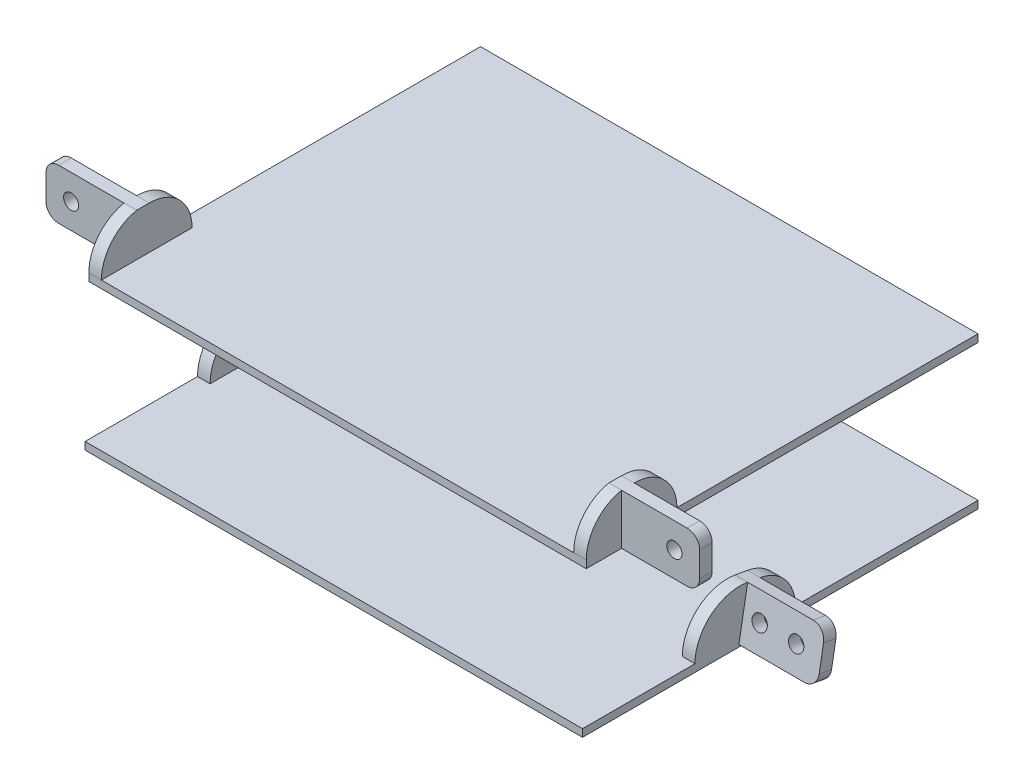
from build123d import *

# Parameters (mm, degrees)
SKETCH1_R                        = 3
LOWER_LEFT_TAB_DEPTH             = 5
BOTTOM_START                     = -5
SKETCH2_W                        = 157
SKETCH2_H                        = 3
BOTTOM_PLATE_EXTRUDE_DEPTH       = 98.75
BOTTOM_TAB_SUPPORT_EXTRUDE_DEPTH = 5
SKETCH5_R                        = 3
TOP_TAB_EXTRUDE_DEPTH            = 5
TOP_START                        = -5
SKETCH6_W                        = 155.527036446
SKETCH6_H                        = 3
TOP_PLATE_EXTRUDE_DEPTH          = 98.75
TOP_TAB_SUPPORT_EXTRUDE_DEPTH    = 5


with BuildPart() as part:
    # Sketch1 → Lower left tab (new body)
    with BuildSketch(Plane(origin=(0, 0, 0), x_dir=(1, 0, 0), z_dir=(0, 0.17364817766693072, 0.984807753012208))):
        with BuildLine():
            Line((-124.75, 10), (-93.75, 10))
            Line((-93.75, 10), (-93.75, -10))
            Line((-93.75, -10), (-124.75, -10))
            ThreePointArc((-124.75, -10), (-128.285533906, -8.535533906), (-129.75, -5))
            Line((-129.75, -5), (-129.75, 5))
            ThreePointArc((-129.75, 5), (-128.285533906, 8.535533906), (-124.75, 10))
        make_face()
        with Locations(Location((-119.75, 0, 0), (0, 0, 270))):
            Circle(SKETCH1_R, mode=Mode.SUBTRACT)
        with Locations(Location((-105.25, 0, 0), (0, 0, 270))):
            Circle(SKETCH1_R, mode=Mode.SUBTRACT)
    lower_left_tab = extrude(amount=LOWER_LEFT_TAB_DEPTH)

    # Sketch2 → Bottom plate extrude (add)
    with BuildSketch(Plane(origin=(-93.75, 0, 0), x_dir=(0, 0, -1), z_dir=(1, 0, 0)).offset(BOTTOM_START)):
        with Locations((9.763518223, -8.34807753)):
            Rectangle(SKETCH2_W, SKETCH2_H)
    bottom_plate_extrude = extrude(amount=BOTTOM_PLATE_EXTRUDE_DEPTH)

    # Sketch4 → Bottom tab support extrude (add)
    with BuildSketch(Plane(origin=(-93.75, 0, 0), x_dir=(0, 0, -1), z_dir=(1, 0, 0))):
        with BuildLine():
            Line((15.74621933, -6.84807753), (-1.207500835, -6.84807753))
            Line((-1.207500835, -6.84807753), (1.736481777, 9.84807753))
            ThreePointArc((1.736481777, 9.84807753), (11.779802288, 4.04956373), (15.74621933, -6.84807753))
        make_face()
        with BuildLine():
            Line((-6.284633894, -6.84807753), (-3.187556988, 10.716318418))
            ThreePointArc((-3.187556988, 10.716318418), (-17.748979146, 6.814597111), (-24.119988962, -6.84807753))
            Line((-24.119988962, -6.84807753), (-6.284633894, -6.84807753))
        make_face()
    bottom_tab_support_extrude = extrude(amount=-BOTTOM_TAB_SUPPORT_EXTRUDE_DEPTH)


with BuildPart() as body_2:
    # Sketch5 → Top tab extrude (new body)
    with BuildSketch(Plane.XY.offset(48.263518223)):
        with BuildLine():
            Line((-124.75, 67.40192247), (-93.75, 67.40192247))
            Line((-93.75, 67.40192247), (-93.75, 47.40192247))
            Line((-93.75, 47.40192247), (-124.75, 47.40192247))
            ThreePointArc((-124.75, 47.40192247), (-128.285533906, 48.866388564), (-129.75, 52.40192247))
            Line((-129.75, 52.40192247), (-129.75, 62.40192247))
            ThreePointArc((-129.75, 62.40192247), (-128.285533906, 65.937456376), (-124.75, 67.40192247))
        make_face()
        with Locations((-119.75, 57.40192247)):
            Circle(SKETCH5_R, mode=Mode.SUBTRACT)
    top_tab_extrude = extrude(amount=TOP_TAB_EXTRUDE_DEPTH)

    # Sketch6 → Top plate extrude (add)
    with BuildSketch(Plane(origin=(-93.75, 0, 0), x_dir=(0, 0, -1), z_dir=(1, 0, 0)).offset(TOP_START)):
        with Locations((10.5, 48.90192247)):
            Rectangle(SKETCH6_W, SKETCH6_H)
    top_plate_extrude = extrude(amount=TOP_PLATE_EXTRUDE_DEPTH)

    # Sketch7 → Top tab support extrude (add)
    with BuildSketch(Plane(origin=(-93.75, 0, 0), x_dir=(0, 0, -1), z_dir=(1, 0, 0))):
        with BuildLine():
            Line((-48.263518223, 50.40192247), (-48.263518223, 67.40192247))
            ThreePointArc((-48.263518223, 67.40192247), (-36.242702943, 62.42273775), (-31.263518223, 50.40192247))
            Line((-31.263518223, 50.40192247), (-48.263518223, 50.40192247))
        make_face()
        with BuildLine():
            Line((-53.263518223, 50.40192247), (-53.263518223, 67.40192247))
            ThreePointArc((-53.263518223, 67.40192247), (-63.31302409, 61.413280243), (-67.263518223, 50.40192247))
            Line((-67.263518223, 50.40192247), (-53.263518223, 50.40192247))
        make_face()
    top_tab_support_extrude = extrude(amount=-TOP_TAB_SUPPORT_EXTRUDE_DEPTH)


with BuildPart() as part_1:
    add(part.part)

    add(body_2.part)  # Mirror 2 merges body 2
    # Mirror 2: Lower left tab, Bottom plate extrude, Bottom tab support extrude, Top tab extrude, Top plate extrude, Top tab support extrude across plane
    add(lower_left_tab.mirror(Plane(origin=(0, 0, 0), x_dir=(0, 0, 1), z_dir=(1, 0, 0))))
    add(bottom_plate_extrude.mirror(Plane(origin=(0, 0, 0), x_dir=(0, 0, 1), z_dir=(1, 0, 0))))
    add(bottom_tab_support_extrude.mirror(Plane(origin=(0, 0, 0), x_dir=(0, 0, 1), z_dir=(1, 0, 0))))
    add(top_tab_extrude.mirror(Plane(origin=(0, 0, 0), x_dir=(0, 0, 1), z_dir=(1, 0, 0))))
    add(top_plate_extrude.mirror(Plane(origin=(0, 0, 0), x_dir=(0, 0, 1), z_dir=(1, 0, 0))))
    add(top_tab_support_extrude.mirror(Plane(origin=(0, 0, 0), x_dir=(0, 0, 1), z_dir=(1, 0, 0))))


solid = part_1.part
